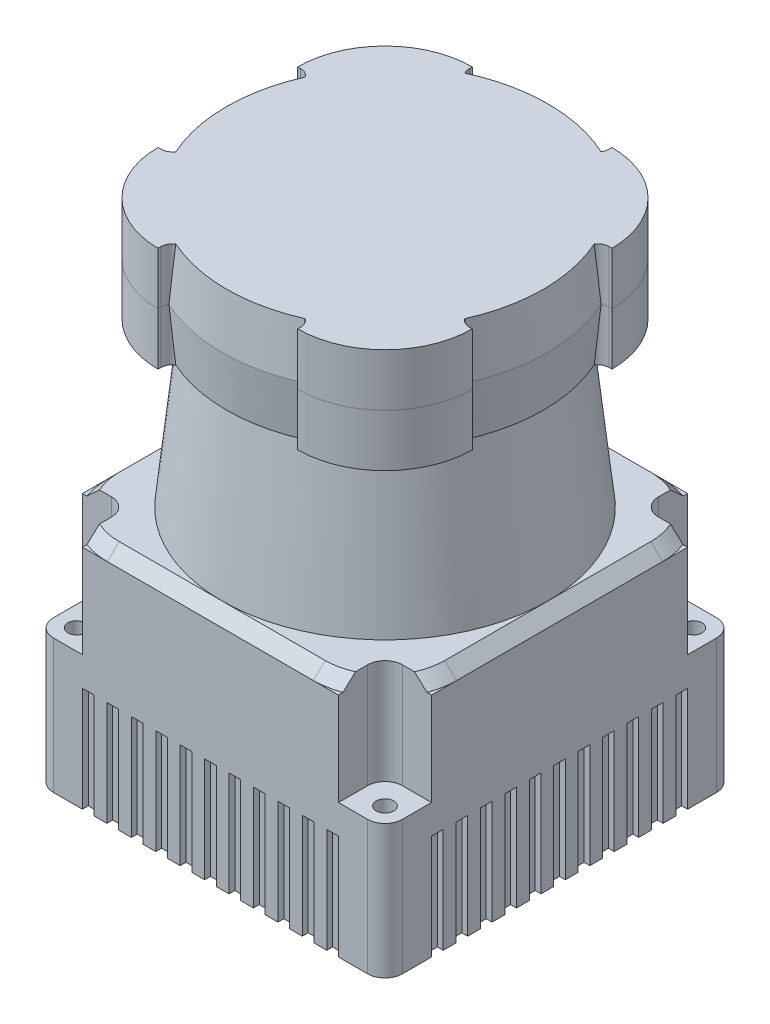
from build123d import *

# Parameters (mm, degrees)
SKETCH3_W                     = 28
SKETCH3_H                     = 28
BOSS_EXTRUDE1_DEPTH           = 5
BOSS_EXTRUDE2_START           = -2
SKETCH4_R                     = 1.5
BOSS_EXTRUDE2_DEPTH           = 39
CUT_EXTRUDE1_START            = -30
SKETCH5_R                     = 3.5
CUT_EXTRUDE1_DEPTH            = 5
CUT_EXTRUDE2_DEPTH            = 18
SKETCH10_W                    = 1
SKETCH10_H                    = 2
SKETCH10_W_2                  = 2
SKETCH10_H_2                  = 1
CUT_EXTRUDE3_DEPTH            = 18
SKETCH11_R                    = 28
BOSS_EXTRUDE3_DEPTH           = 9
BOSS_EXTRUDE3_TAPER           = 5
BOSS_EXTRUDE3_OTHER_WAY_DEPTH = 9
BOSS_EXTRUDE3_OTHER_WAY_TAPER = 5
BOSS_EXTRUDE4_DEPTH           = 9


with BuildPart() as part:
    # Sketch2 → Revolve1 (revolve)
    with BuildSketch(Plane.XY):
        Polygon((0, 0), (-28, 0), (-25, 28), (0, 28), align=None)
    revolve(axis=Axis((0, 28, 0), (0, -1, 0)))

    # Sketch3 → Boss-Extrude1 (add, symmetric)
    with BuildSketch(Plane(origin=(0, 0, 0), x_dir=(0, 0, -1), z_dir=(1, 0, 0))):
        with Locations((14, 14)):
            Rectangle(SKETCH3_W, SKETCH3_H)
    extrude(amount=BOSS_EXTRUDE1_DEPTH, both=True)


with BuildPart() as body_2:
    # Sketch4 → Boss-Extrude2 (new body)
    with BuildSketch(Plane(origin=(0, 0, 0), x_dir=(1, 0, 0), z_dir=(0, 1, 0)).offset(BOSS_EXTRUDE2_START)):
        with BuildLine():
            Line((27, -30), (-27, -30))
            ThreePointArc((-27, -30), (-29.121320344, -29.121320344), (-30, -27))
            Line((-30, -27), (-30, 27))
            ThreePointArc((-30, 27), (-29.121320344, 29.121320344), (-27, 30))
            Line((-27, 30), (27, 30))
            ThreePointArc((27, 30), (29.121320344, 29.121320344), (30, 27))
            Line((30, 27), (30, -27))
            ThreePointArc((30, -27), (29.121320344, -29.121320344), (27, -30))
        make_face()
        with Locations(Location((-26.5, 26.5, 0), (0, 0, 270))):
            Circle(SKETCH4_R, mode=Mode.SUBTRACT)
        with Locations(Location((26.5, 26.5, 0), (0, 0, 270))):
            Circle(SKETCH4_R, mode=Mode.SUBTRACT)
        with Locations(Location((26.5, -26.5, 0), (0, 0, 270))):
            Circle(SKETCH4_R, mode=Mode.SUBTRACT)
        with Locations(Location((-26.5, -26.5, 0), (0, 0, 270))):
            Circle(SKETCH4_R, mode=Mode.SUBTRACT)
    extrude(amount=-BOSS_EXTRUDE2_DEPTH)

    # Sketch5 → Cut-Extrude1 (cut)
    with BuildSketch(Plane.XY.offset(CUT_EXTRUDE1_START)):
        with Locations(Location((-15, -32, 0), (0, 0, 180))):
            Circle(SKETCH5_R)
        with Locations(Location((15, -32, 0), (0, 0, 180))):
            Circle(SKETCH5_R)
    extrude(amount=CUT_EXTRUDE1_DEPTH, mode=Mode.SUBTRACT)

    # Sweep2: sweep along a path in Sketch7
    with BuildLine(Plane(origin=(0, -2, 0), x_dir=(1, 0, 0), z_dir=(0, 1, 0))) as sweep2_path:
        Line((17.7, 25), (-17.7, 25))
        ThreePointArc((-17.7, 25), (-22.861879503, 22.861879503), (-25, 17.7))
        Line((-25, 17.7), (-25, -17.7))
        ThreePointArc((-25, -17.7), (-22.861879503, -22.861879503), (-17.7, -25))
        Line((-17.7, -25), (17.7, -25))
        ThreePointArc((17.7, -25), (22.861879503, -22.861879503), (25, -17.7))
        Line((25, -17.7), (25, 17.7))
        ThreePointArc((25, 17.7), (22.861879503, 22.861879503), (17.7, 25))
    # Sketch9 → Sweep2 (sweep)
    with BuildSketch(Plane(origin=(0, 0, 0), x_dir=(0, 0, -1), z_dir=(1, 0, 0))):
        Polygon((-30, -2), (-28, 0), (-20, 0), (-20, -2), align=None)
    sweep(path=sweep2_path.line)

    # Sketch6 → Cut-Extrude2 (cut)
    with BuildSketch(Plane(origin=(0, 0, 0), x_dir=(1, 0, 0), z_dir=(0, 1, 0))):
        with BuildLine():
            Line((-30, 22), (-25, 22))
            ThreePointArc((-25, 22), (-22.878679656, 22.878679656), (-22, 25))
            Line((-22, 25), (-22, 30))
            Line((-22, 30), (-27, 30))
            ThreePointArc((-27, 30), (-29.121320344, 29.121320344), (-30, 27))
            Line((-30, 27), (-30, 22))
        make_face()
        with BuildLine():
            Line((30, 22), (30, 27))
            ThreePointArc((30, 27), (29.121320344, 29.121320344), (27, 30))
            Line((27, 30), (22, 30))
            Line((22, 30), (22, 25))
            ThreePointArc((22, 25), (22.878679656, 22.878679656), (25, 22))
            Line((25, 22), (30, 22))
        make_face()
        with BuildLine():
            Line((22, -30), (27, -30))
            ThreePointArc((27, -30), (29.121320344, -29.121320344), (30, -27))
            Line((30, -27), (30, -22))
            Line((30, -22), (25, -22))
            ThreePointArc((25, -22), (22.878679656, -22.878679656), (22, -25))
            Line((22, -25), (22, -30))
        make_face()
        with BuildLine():
            Line((-30, -22), (-30, -27))
            ThreePointArc((-30, -27), (-29.121320344, -29.121320344), (-27, -30))
            Line((-27, -30), (-22, -30))
            Line((-22, -30), (-22, -25))
            ThreePointArc((-22, -25), (-22.878679656, -22.878679656), (-25, -22))
            Line((-25, -22), (-30, -22))
        make_face()
    extrude(amount=-CUT_EXTRUDE2_DEPTH, mode=Mode.SUBTRACT)

    # Sketch10 → Cut-Extrude3 (cut)
    with BuildSketch(Plane.XZ.offset(41)):
        with Locations((-29.5, 16.8)):
            Rectangle(SKETCH10_W, SKETCH10_H)
        with Locations((-29.5, 21)):
            Rectangle(SKETCH10_W, SKETCH10_H)
        with Locations((-29.5, 12.6)):
            Rectangle(SKETCH10_W, SKETCH10_H)
        with Locations((-29.5, 8.4)):
            Rectangle(SKETCH10_W, SKETCH10_H)
        with Locations((-29.5, 4.2)):
            Rectangle(SKETCH10_W, SKETCH10_H)
        with Locations((-29.5, 0)):
            Rectangle(SKETCH10_W, SKETCH10_H)
        with Locations((-29.5, -4.2)):
            Rectangle(SKETCH10_W, SKETCH10_H)
        with Locations((-29.5, -8.4)):
            Rectangle(SKETCH10_W, SKETCH10_H)
        with Locations((-29.5, -12.6)):
            Rectangle(SKETCH10_W, SKETCH10_H)
        with Locations((-29.5, -16.8)):
            Rectangle(SKETCH10_W, SKETCH10_H)
        with Locations((-29.5, -21)):
            Rectangle(SKETCH10_W, SKETCH10_H)
        with Locations((16.8, 29.5)):
            Rectangle(SKETCH10_W_2, SKETCH10_H_2)
        with Locations((21, 29.5)):
            Rectangle(SKETCH10_W_2, SKETCH10_H_2)
        with Locations((12.6, 29.5)):
            Rectangle(SKETCH10_W_2, SKETCH10_H_2)
        with Locations((8.4, 29.5)):
            Rectangle(SKETCH10_W_2, SKETCH10_H_2)
        with Locations((4.2, 29.5)):
            Rectangle(SKETCH10_W_2, SKETCH10_H_2)
        with Locations((0, 29.5)):
            Rectangle(SKETCH10_W_2, SKETCH10_H_2)
        with Locations((-4.2, 29.5)):
            Rectangle(SKETCH10_W_2, SKETCH10_H_2)
        with Locations((-8.4, 29.5)):
            Rectangle(SKETCH10_W_2, SKETCH10_H_2)
        with Locations((-12.6, 29.5)):
            Rectangle(SKETCH10_W_2, SKETCH10_H_2)
        with Locations((-16.8, 29.5)):
            Rectangle(SKETCH10_W_2, SKETCH10_H_2)
        with Locations((-21, 29.5)):
            Rectangle(SKETCH10_W_2, SKETCH10_H_2)
        with Locations((29.5, -16.8)):
            Rectangle(SKETCH10_W, SKETCH10_H)
        with Locations((29.5, -21)):
            Rectangle(SKETCH10_W, SKETCH10_H)
        with Locations((29.5, -12.6)):
            Rectangle(SKETCH10_W, SKETCH10_H)
        with Locations((29.5, -8.4)):
            Rectangle(SKETCH10_W, SKETCH10_H)
        with Locations((29.5, -4.2)):
            Rectangle(SKETCH10_W, SKETCH10_H)
        with Locations((29.5, 0)):
            Rectangle(SKETCH10_W, SKETCH10_H)
        with Locations((29.5, 4.2)):
            Rectangle(SKETCH10_W, SKETCH10_H)
        with Locations((29.5, 8.4)):
            Rectangle(SKETCH10_W, SKETCH10_H)
        with Locations((29.5, 12.6)):
            Rectangle(SKETCH10_W, SKETCH10_H)
        with Locations((29.5, 16.8)):
            Rectangle(SKETCH10_W, SKETCH10_H)
        with Locations((29.5, 21)):
            Rectangle(SKETCH10_W, SKETCH10_H)
        with Locations((-16.8, -29.5)):
            Rectangle(SKETCH10_W_2, SKETCH10_H_2)
        with Locations((-21, -29.5)):
            Rectangle(SKETCH10_W_2, SKETCH10_H_2)
        with Locations((-12.6, -29.5)):
            Rectangle(SKETCH10_W_2, SKETCH10_H_2)
        with Locations((-8.4, -29.5)):
            Rectangle(SKETCH10_W_2, SKETCH10_H_2)
        with Locations((-4.2, -29.5)):
            Rectangle(SKETCH10_W_2, SKETCH10_H_2)
        with Locations((0, -29.5)):
            Rectangle(SKETCH10_W_2, SKETCH10_H_2)
        with Locations((4.2, -29.5)):
            Rectangle(SKETCH10_W_2, SKETCH10_H_2)
        with Locations((8.4, -29.5)):
            Rectangle(SKETCH10_W_2, SKETCH10_H_2)
        with Locations((12.6, -29.5)):
            Rectangle(SKETCH10_W_2, SKETCH10_H_2)
        with Locations((16.8, -29.5)):
            Rectangle(SKETCH10_W_2, SKETCH10_H_2)
        with Locations((21, -29.5)):
            Rectangle(SKETCH10_W_2, SKETCH10_H_2)
    extrude(amount=-CUT_EXTRUDE3_DEPTH, mode=Mode.SUBTRACT)


with BuildPart() as body_3:
    # Sketch11 → Boss-Extrude3 (new body)
    with BuildSketch(Plane(origin=(0, 37, 0), x_dir=(1, 0, 0), z_dir=(0, 1, 0))):
        Circle(SKETCH11_R)
    extrude(amount=BOSS_EXTRUDE3_DEPTH, taper=BOSS_EXTRUDE3_TAPER)

    # Sketch11 → Boss-Extrude3 other way (add)
    with BuildSketch(Plane(origin=(0, 37, 0), x_dir=(1, 0, 0), z_dir=(0, 1, 0))):
        Circle(SKETCH11_R)
    extrude(amount=-BOSS_EXTRUDE3_OTHER_WAY_DEPTH, taper=BOSS_EXTRUDE3_OTHER_WAY_TAPER)

    # Sketch11<3> → Boss-Extrude4 (add, symmetric)
    with BuildSketch(Plane(origin=(0, 37, 0), x_dir=(1, 0, 0), z_dir=(0, 1, 0))):
        with BuildLine():
            ThreePointArc((-25.440154115, 11.696091595), (-19.798989873, 19.798989873), (-11.696091595, 25.440154115))
            ThreePointArc((-11.696091595, 25.440154115), (-11.922522196, 25.948721119), (-12, 26.5))
            Line((-12, 26.5), (-12, 27))
            ThreePointArc((-12, 27), (-22.606601718, 22.606601718), (-27, 12))
            Line((-27, 12), (-26.5, 12))
            ThreePointArc((-26.5, 12), (-25.948721119, 11.922522196), (-25.440154115, 11.696091595))
        make_face()
        with BuildLine():
            Line((10, 24.5), (-10, 24.5))
            ThreePointArc((-10, 24.5), (-10.969615447, 24.750758483), (-11.696091595, 25.440154115))
            ThreePointArc((-11.696091595, 25.440154115), (-19.798989873, 19.798989873), (-25.440154115, 11.696091595))
            ThreePointArc((-25.440154115, 11.696091595), (-24.750758483, 10.969615447), (-24.5, 10))
            Line((-24.5, 10), (-24.5, -10))
            ThreePointArc((-24.5, -10), (-24.750758483, -10.969615447), (-25.440154115, -11.696091595))
            ThreePointArc((-25.440154115, -11.696091595), (-19.798989873, -19.798989873), (-11.696091595, -25.440154115))
            ThreePointArc((-11.696091595, -25.440154115), (-10.969615447, -24.750758483), (-10, -24.5))
            Line((-10, -24.5), (10, -24.5))
            ThreePointArc((10, -24.5), (10.969615447, -24.750758483), (11.696091595, -25.440154115))
            ThreePointArc((11.696091595, -25.440154115), (19.798989873, -19.798989873), (25.440154115, -11.696091595))
            ThreePointArc((25.440154115, -11.696091595), (24.750758483, -10.969615447), (24.5, -10))
            Line((24.5, -10), (24.5, 10))
            ThreePointArc((24.5, 10), (24.750758483, 10.969615447), (25.440154115, 11.696091595))
            ThreePointArc((25.440154115, 11.696091595), (19.798989873, 19.798989873), (11.696091595, 25.440154115))
            ThreePointArc((11.696091595, 25.440154115), (10.969615447, 24.750758483), (10, 24.5))
        make_face()
        with BuildLine():
            ThreePointArc((-11.696091595, -25.440154115), (-19.798989873, -19.798989873), (-25.440154115, -11.696091595))
            ThreePointArc((-25.440154115, -11.696091595), (-25.948721119, -11.922522196), (-26.5, -12))
            Line((-26.5, -12), (-27, -12))
            ThreePointArc((-27, -12), (-22.606601718, -22.606601718), (-12, -27))
            Line((-12, -27), (-12, -26.5))
            ThreePointArc((-12, -26.5), (-11.922522196, -25.948721119), (-11.696091595, -25.440154115))
        make_face()
        with BuildLine():
            ThreePointArc((26.5, -12), (25.948721119, -11.922522196), (25.440154115, -11.696091595))
            ThreePointArc((25.440154115, -11.696091595), (19.798989873, -19.798989873), (11.696091595, -25.440154115))
            ThreePointArc((11.696091595, -25.440154115), (11.922522196, -25.948721119), (12, -26.5))
            Line((12, -26.5), (12, -27))
            ThreePointArc((12, -27), (22.606601718, -22.606601718), (27, -12))
            Line((27, -12), (26.5, -12))
        make_face()
        with BuildLine():
            ThreePointArc((12, 26.5), (11.922522196, 25.948721119), (11.696091595, 25.440154115))
            ThreePointArc((11.696091595, 25.440154115), (19.798989873, 19.798989873), (25.440154115, 11.696091595))
            ThreePointArc((25.440154115, 11.696091595), (25.948721119, 11.922522196), (26.5, 12))
            Line((26.5, 12), (27, 12))
            ThreePointArc((27, 12), (22.606601718, 22.606601718), (12, 27))
            Line((12, 27), (12, 26.5))
        make_face()
        with BuildLine():
            ThreePointArc((-11.696091595, 25.440154115), (-10.969615447, 24.750758483), (-10, 24.5))
            Line((-10, 24.5), (10, 24.5))
            ThreePointArc((10, 24.5), (10.969615447, 24.750758483), (11.696091595, 25.440154115))
            ThreePointArc((11.696091595, 25.440154115), (0, 28), (-11.696091595, 25.440154115))
        make_face()
    extrude(amount=BOSS_EXTRUDE4_DEPTH, both=True)


with BuildPart() as body_4:
    # Split1: the piece on the far side of the plane
    add(body_3.part)
    split(bisect_by=Plane.ZX.offset(37), keep=Keep.BOTTOM)


with BuildPart() as body_3_1:
    add(body_3.part)

    # Split1
    split(bisect_by=Plane.ZX.offset(37), keep=Keep.TOP)


solid = Compound([part.part, body_2.part, body_4.part, body_3_1.part])
